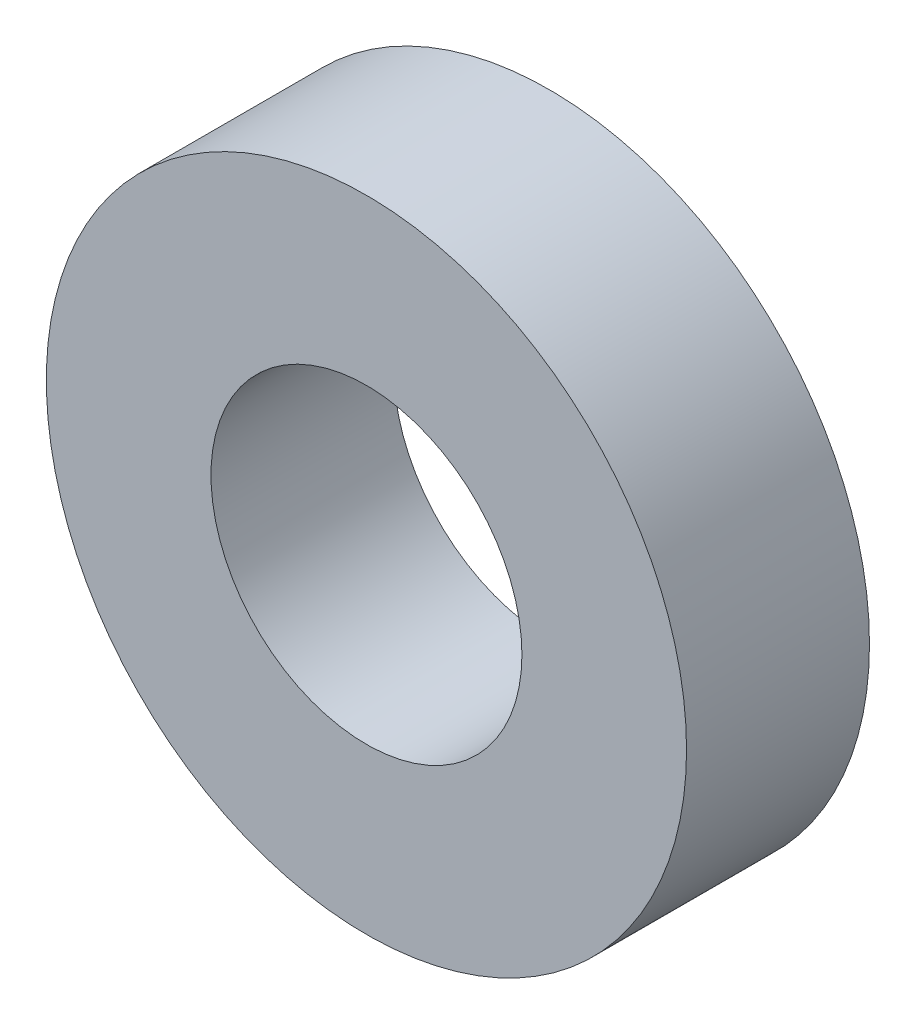
from build123d import *

# Parameters (mm, degrees)
REAR_BEARING_START = -47
SKETCH_1_R         = 17.5
SKETCH_1_R_2       = 8.5
REAR_BEARING_DEPTH = 10


with BuildPart() as part:
    # Эскиз1 → Rear_bearing (new body)
    with BuildSketch(Plane.XY.offset(REAR_BEARING_START)):
        Circle(SKETCH_1_R)
        Circle(SKETCH_1_R_2, mode=Mode.SUBTRACT)
    extrude(amount=REAR_BEARING_DEPTH)


solid = part.part
